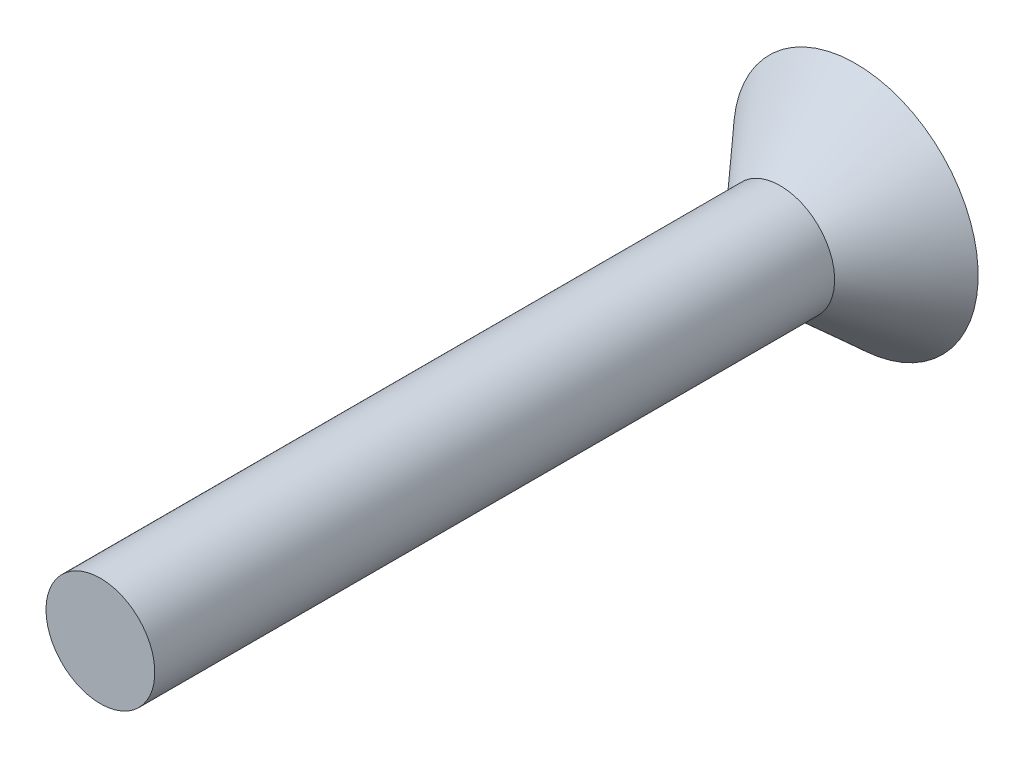
from build123d import *

# Parameters (mm, degrees)
H1_CROSSRECESS_4DEG_DEPTH = 0.762
H1_CROSSRECESS_4DEG_DRAFT = 4


with BuildPart() as part:
    # H1_SK_profile → H1_Body (revolve)
    with BuildSketch(Plane(origin=(0, 0, 0), x_dir=(0, 0, -1), z_dir=(1, 0, 0)), mode=Mode.PRIVATE) as h1_body_sk:
        Polygon((11.43, 0), (11.43, 2.0574), (10.16, 0.9144), (-1.27, 0.9144), (-1.27, 0), align=None)
    revolve(h1_body_sk.sketch.rotate(Axis((0, 0, -15.24), (0, 0, 1)), 90), axis=Axis((0, 0, -15.24), (0, 0, 1)))


with BuildPart() as h1_crossrecess_4deg_tool:
    # H1_SK_crossRecess → H1_CrossRecess_4deg (with draft: the straight prism first)
    with BuildSketch(Plane.XY.offset(-11.43)):
        Polygon((1.3462, -0.2159), (1.3462, 0.2159), (0.5969, 0.2159), (0.2159, 0.5969), (0.2159, 1.3462), (-0.2159, 1.3462), (-0.2159, 0.5969), (-0.5969, 0.2159), (-1.3462, 0.2159), (-1.3462, -0.2159), (-0.5969, -0.2159), (-0.2159, -0.5969), (-0.2159, -1.3462), (0.2159, -1.3462), (0.2159, -0.5969), (0.5969, -0.2159), align=None)
    extrude(amount=H1_CROSSRECESS_4DEG_DEPTH)
    # H1_CrossRecess_4deg: the draft: its side faces are tilted about the plane it starts from
    h1_crossrecess_4deg_sides = [h1_crossrecess_4deg_tool.faces().sort_by_distance(p)[0] for p in [
        (1.3462, 0, -11.049),
        (0.97155, 0.2159, -11.049),
        (0.4064, 0.4064, -11.049),
        (0.2159, 0.97155, -11.049),
        (0, 1.3462, -11.049),
        (-0.2159, 0.97155, -11.049),
        (-0.4064, 0.4064, -11.049),
        (-0.97155, 0.2159, -11.049),
        (-1.3462, 0, -11.049),
        (-0.97155, -0.2159, -11.049),
        (-0.4064, -0.4064, -11.049),
        (-0.2159, -0.97155, -11.049),
        (0, -1.3462, -11.049),
        (0.2159, -0.97155, -11.049),
        (0.4064, -0.4064, -11.049),
        (0.97155, -0.2159, -11.049),
    ]]
    draft(h1_crossrecess_4deg_sides, Plane.XY.offset(-11.43), H1_CROSSRECESS_4DEG_DRAFT)


with BuildPart() as part_1:
    add(part.part)

    # H1_CrossRecess_4deg: cut by h1_crossrecess_4deg_tool
    add(h1_crossrecess_4deg_tool.part, mode=Mode.SUBTRACT)


solid = part_1.part
